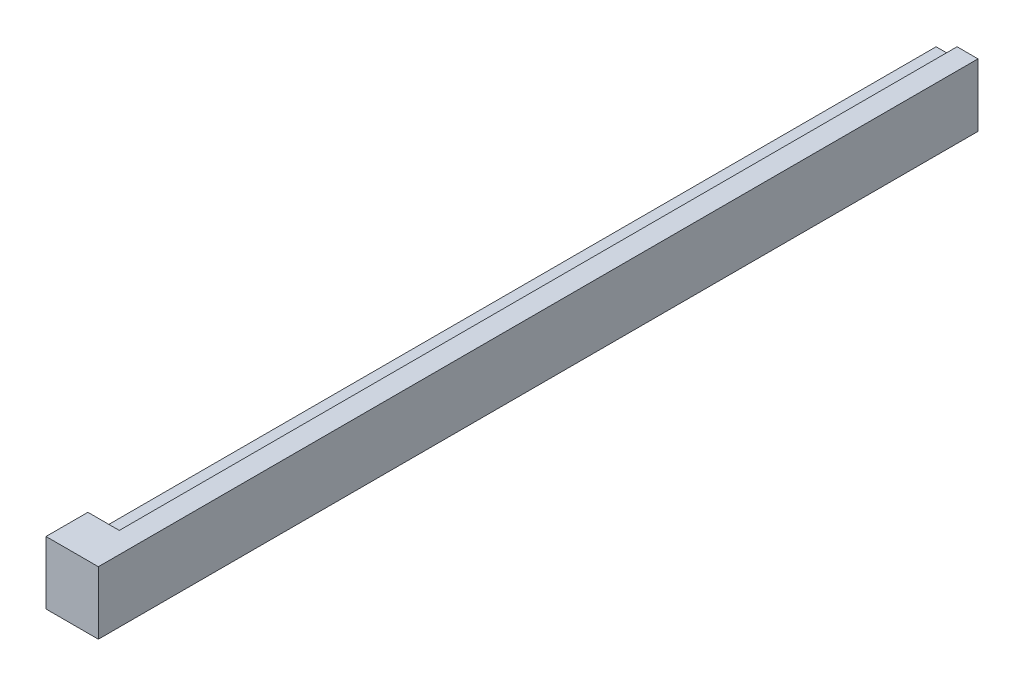
from build123d import *

# Parameters (mm, degrees)
BOSS_EXTRUDE1_DEPTH = 1000
SKETCH2_W           = 125
SKETCH2_H           = 150
BOSS_EXTRUDE2_DEPTH = 100
SKETCH3_R           = 10
CUT_EXTRUDE1_DEPTH  = 10


with BuildPart() as part:
    # Sketch1 → Boss-Extrude1 (new, symmetric)
    with BuildSketch(Plane.XY):
        Polygon((0, 0), (0, 25), (25, 25), (25, 50), (50, 50), (50, 25), (75, 25), (75, 75), (125, 75), (125, -75), (75, -75), (75, -25), (50, -25), (50, -50), (25, -50), (25, -25), (0, -25), align=None)
    extrude(amount=BOSS_EXTRUDE1_DEPTH, both=True)

    # Sketch2 → Boss-Extrude2 (add)
    with BuildSketch(Plane.XY.offset(1000)):
        with Locations((62.5, 0)):
            Rectangle(SKETCH2_W, SKETCH2_H)
    extrude(amount=BOSS_EXTRUDE2_DEPTH)

    # Sketch3 → Cut-Extrude1 (cut)
    with BuildSketch(Plane(origin=(0, 0, -1000), x_dir=(-1, 0, 0), z_dir=(0, 0, -1))):
        with Locations((-100, 50)):
            Circle(SKETCH3_R)
        with Locations((-100, -50)):
            Circle(SKETCH3_R)
    extrude(amount=-CUT_EXTRUDE1_DEPTH, mode=Mode.SUBTRACT)


solid = part.part
